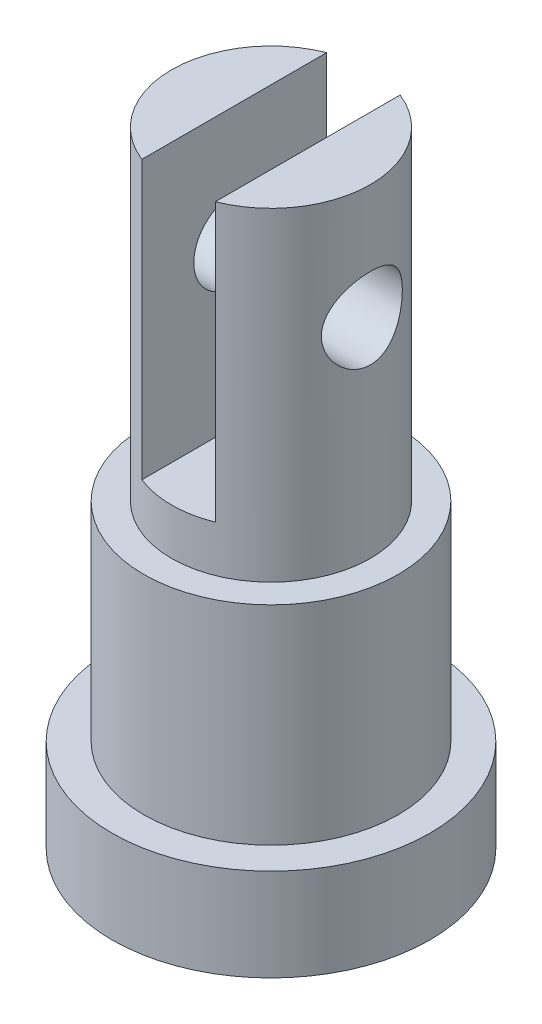
from build123d import *

# Parameters (mm, degrees)
SKETCH1_R               = 6.875
BOSS_EXTRUDE1_DEPTH     = 4
SKETCH2_R               = 5.5
BOSS_EXTRUDE2_DEPTH     = 9
SKETCH3_R               = 4.3
BOSS_EXTRUDE3_DEPTH     = 14
SKETCH4_W               = 3.175
SKETCH4_H               = 8.6
CUT_EXTRUDE1_DEPTH      = 12
CUT_EXTRUDE2_DEPTH      = 30.118371027
CUT_EXTRUDE2_DEPTH_BACK = 30.118371027
SKETCH5_R               = 1.75


with BuildPart() as part:
    # Sketch1 → Boss-Extrude1 (new body)
    with BuildSketch(Plane(origin=(0, 0, 0), x_dir=(1, 0, 0), z_dir=(0, 1, 0))):
        with Locations(Location((0, 0, 0), (0, 0, 270))):
            Circle(SKETCH1_R)
    extrude(amount=BOSS_EXTRUDE1_DEPTH)

    # Sketch2 → Boss-Extrude2 (add)
    with BuildSketch(Plane(origin=(0, 4, 0), x_dir=(1, 0, 0), z_dir=(0, 1, 0))):
        with Locations(Location((0, 0, 0), (0, 0, 270))):
            Circle(SKETCH2_R)
    extrude(amount=BOSS_EXTRUDE2_DEPTH)

    # Sketch3 → Boss-Extrude3 (add)
    with BuildSketch(Plane(origin=(0, 13, 0), x_dir=(1, 0, 0), z_dir=(0, 1, 0))):
        with Locations(Location((0, 0, 0), (0, 0, 270))):
            Circle(SKETCH3_R)
    extrude(amount=BOSS_EXTRUDE3_DEPTH)

    # Sketch4 → Cut-Extrude1 (cut)
    with BuildSketch(Plane(origin=(0, 27, 0), x_dir=(1, 0, 0), z_dir=(0, 1, 0))):
        Rectangle(SKETCH4_W, SKETCH4_H)
    extrude(amount=-CUT_EXTRUDE1_DEPTH, mode=Mode.SUBTRACT)

    # Sketch5 → Cut-Extrude2 (cut, two sides: drawn at the far end of the back side and taken through both)
    with BuildSketch(Plane.ZY.offset(-1.5875).offset(-CUT_EXTRUDE2_DEPTH_BACK)):
        with Locations((0, 22)):
            Circle(SKETCH5_R)
    extrude(amount=CUT_EXTRUDE2_DEPTH + CUT_EXTRUDE2_DEPTH_BACK, mode=Mode.SUBTRACT)


solid = part.part
